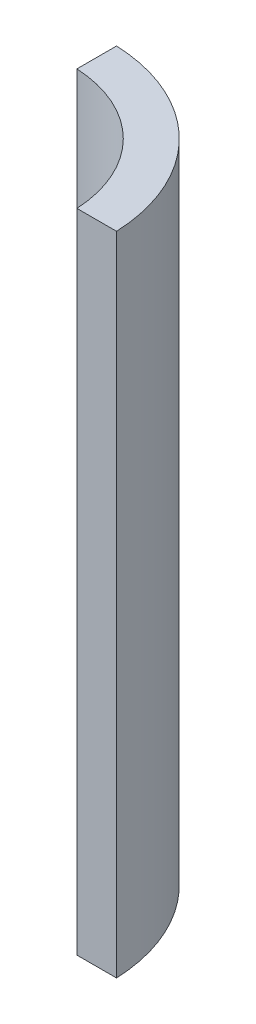
from build123d import *

# Parameters (mm, degrees)
BOSS_EXTRUDE1_DEPTH = 147


with BuildPart() as part:
    # Sketch1 → Boss-Extrude1 (new body)
    with BuildSketch(Plane(origin=(0, 0, 0), x_dir=(1, 0, 0), z_dir=(0, 1, 0))):
        with BuildLine():
            Line((28.961180915, 1.5), (37.970383195, 1.5))
            ThreePointArc((37.970383195, 1.5), (26.870057685, 26.870057685), (1.5, 37.970383195))
            Line((1.5, 37.970383195), (1.5, 28.961180915))
            ThreePointArc((1.5, 28.961180915), (20.506096654, 20.506096654), (28.961180915, 1.5))
        make_face()
    extrude(amount=BOSS_EXTRUDE1_DEPTH)


solid = part.part
